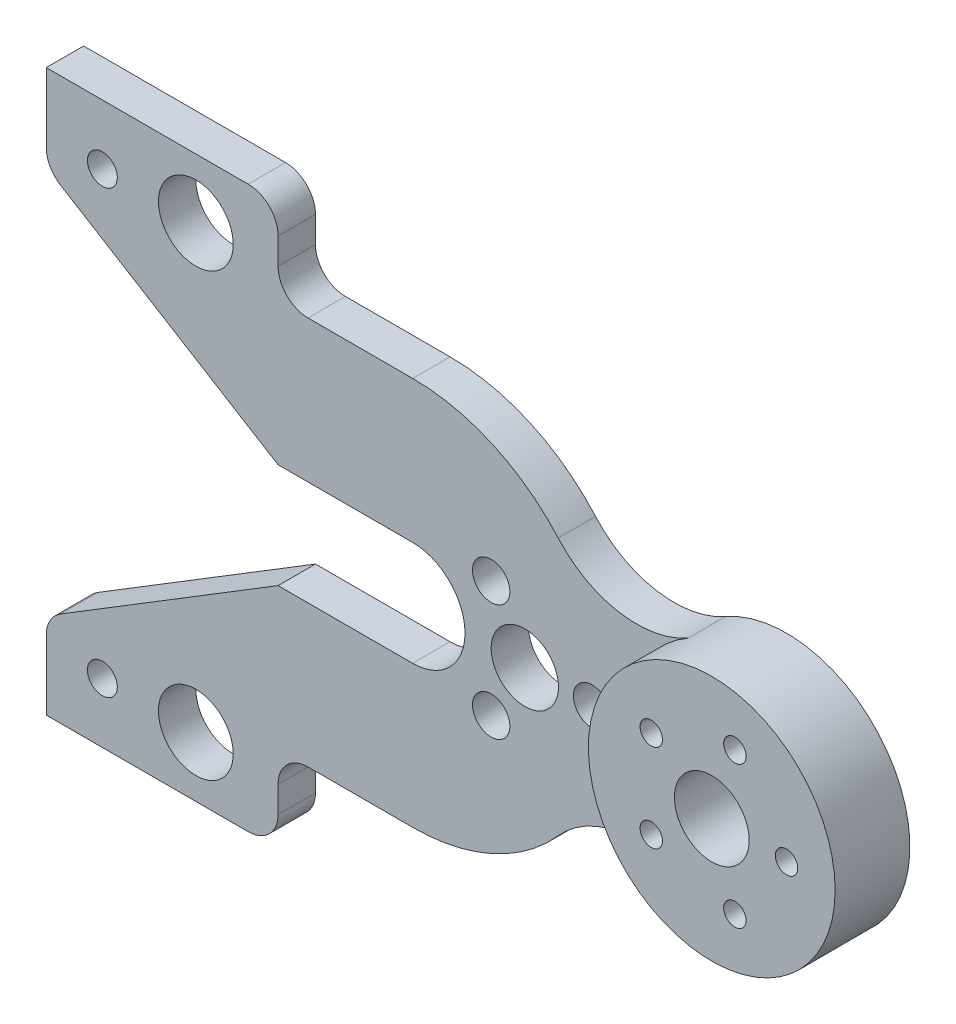
from build123d import *

# Parameters (mm, degrees)
SKETCH_1_R      = 4
SKETCH_1_R_2    = 10
SKETCH_1_R_3    = 5
SKETCH_1_R_4    = 9
EXTRUDE_1_DEPTH = 10
SKETCH_1_3_R    = 3
SKETCH_1_3_R_2  = 10
EXTRUDE_2_DEPTH = 20


with BuildPart() as part:
    # Эскиз1 → Бобышка-Вытянуть1 (new body)
    with BuildSketch(Plane.XY):
        with BuildLine():
            Line((-134, 75), (-188, 75))
            Line((-188, 75), (-188, 56.479823981))
            ThreePointArc((-188, 56.479823981), (-186.980113599, 52.571113945), (-184.180496463, 49.659013961))
            Line((-184.180496463, 49.659013961), (-126, 14))
            Line((-126, 14), (-90, 14))
            ThreePointArc((-90, 14), (-76, 0), (-90, -14))
            Line((-90, -14), (-126, -14))
            Line((-126, -14), (-184.180496463, -49.659013961))
            ThreePointArc((-184.180496463, -49.659013961), (-186.980113599, -52.571113945), (-188, -56.479823981))
            Line((-188, -56.479823981), (-188, -75))
            Line((-188, -75), (-134, -75))
            ThreePointArc((-134, -75), (-128.343145751, -72.656854249), (-126, -67))
            Line((-126, -67), (-126, -60))
            ThreePointArc((-126, -60), (-123.656854249, -54.343145751), (-118, -52))
            Line((-118, -52), (-90, -52))
            ThreePointArc((-90, -52), (-68.657428628, -47.418294436), (-51.075833333, -34.480563355))
            ThreePointArc((-51.075833333, -34.480563355), (-34.708861379, -25.426163433), (-16.292622951, -28.697568493))
            ThreePointArc((-16.292622951, -28.697568493), (-33, 0), (-16.292622951, 28.697568493))
            ThreePointArc((-16.292622951, 28.697568493), (-34.708861379, 25.426163433), (-51.075833333, 34.480563355))
            ThreePointArc((-51.075833333, 34.480563355), (-68.657428628, 47.418294436), (-90, 52))
            Line((-90, 52), (-118, 52))
            ThreePointArc((-118, 52), (-123.656854249, 54.343145751), (-126, 60))
            Line((-126, 60), (-126, 67))
            ThreePointArc((-126, 67), (-128.343145751, 72.656854249), (-134, 75))
        make_face()
        with Locations((-173, -59)):
            Circle(SKETCH_1_R, mode=Mode.SUBTRACT)
        with Locations((-148, -59)):
            Circle(SKETCH_1_R_2, mode=Mode.SUBTRACT)
        with Locations((-69, -15.588457268)):
            Circle(SKETCH_1_R_3, mode=Mode.SUBTRACT)
        with Locations((-173, 59)):
            Circle(SKETCH_1_R, mode=Mode.SUBTRACT)
        with Locations((-148, 59)):
            Circle(SKETCH_1_R_2, mode=Mode.SUBTRACT)
        with Locations((-60, 0)):
            Circle(SKETCH_1_R_4, mode=Mode.SUBTRACT)
        with Locations((-69, 15.588457268)):
            Circle(SKETCH_1_R_3, mode=Mode.SUBTRACT)
        with Locations((-42, 0)):
            Circle(SKETCH_1_R_3, mode=Mode.SUBTRACT)
    extrude(amount=EXTRUDE_1_DEPTH)

    # Эскиз1<3> → Бобышка-Вытянуть2 (add)
    with BuildSketch(Plane.XY):
        with BuildLine():
            ThreePointArc((33, 0), (16.603364759, 28.518910896), (-16.292622951, 28.697568493))
            ThreePointArc((-16.292622951, 28.697568493), (-33, 0), (-16.292622951, -28.697568493))
            ThreePointArc((-16.292622951, -28.697568493), (16.603364759, -28.518910896), (33, 0))
        make_face()
        with Locations((6.180339887, -19.021130326)):
            Circle(SKETCH_1_3_R, mode=Mode.SUBTRACT)
        with Locations((-16.180339887, -11.755705046)):
            Circle(SKETCH_1_3_R, mode=Mode.SUBTRACT)
        Circle(SKETCH_1_3_R_2, mode=Mode.SUBTRACT)
        with Locations((-16.180339887, 11.755705046)):
            Circle(SKETCH_1_3_R, mode=Mode.SUBTRACT)
        with Locations((20, 0)):
            Circle(SKETCH_1_3_R, mode=Mode.SUBTRACT)
        with Locations((6.180339887, 19.021130326)):
            Circle(SKETCH_1_3_R, mode=Mode.SUBTRACT)
    extrude(amount=EXTRUDE_2_DEPTH)


solid = part.part
